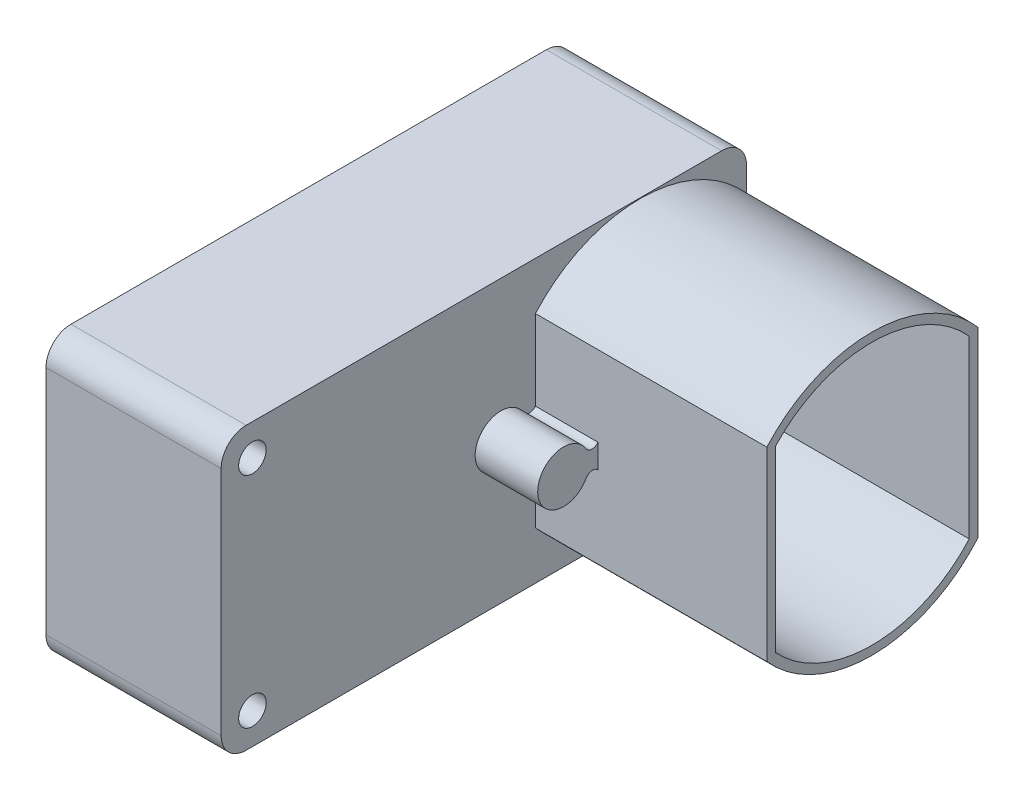
from build123d import *
from build123d.topology import SkipClean

# Parameters (mm, degrees)
SKETCH1_W           = 14
SKETCH1_H           = 42
BOSS_EXTRUDE1_DEPTH = 22.5
FILLET1_R           = 2
BOSS_EXTRUDE2_DEPTH = 18.5
BOSS_EXTRUDE3_DEPTH = 5
SKETCH4_R           = 1.1
CUT_EXTRUDE1_DEPTH  = 15
SKETCH5_W           = 2
SKETCH5_H           = 4
BOSS_EXTRUDE4_DEPTH = 5
BOSS_EXTRUDE5_DEPTH = 4
CUT_EXTRUDE2_START  = -2
CUT_EXTRUDE2_DEPTH  = 2
SKETCH12_R          = 3.5
SKETCH12_R_2        = 3.070336519
BOSS_EXTRUDE6_DEPTH = 1
SKETCH14_R          = 3
BOSS_EXTRUDE7_DEPTH = 1
SKETCH15_R          = 1
BOSS_EXTRUDE8_DEPTH = 7
SKETCH16_R          = 2
BOSS_EXTRUDE9_DEPTH = 1.5
CUT_EXTRUDE3_DEPTH  = 18.5


with BuildPart() as part:
    # Sketch1 → Boss-Extrude1 (new body)
    with BuildSketch(Plane(origin=(0, 0, 0), x_dir=(1, 0, 0), z_dir=(0, 1, 0))):
        with Locations((-14.72963025, -0.456790856)):
            Rectangle(SKETCH1_W, SKETCH1_H)
    extrude(amount=BOSS_EXTRUDE1_DEPTH)

    # Fillet1
    fillet1_edges = [part.edges().sort_by_distance(p)[0] for p in [
        (-14.72963025, 22.5, -20.543209144),
        (-14.72963025, 0, -20.543209144),
        (-14.72963025, 0, 21.456790856),
        (-14.72963025, 22.5, 21.456790856),
    ]]
    fillet(fillet1_edges, radius=FILLET1_R)

    # Sketch2 → Boss-Extrude2 (add)
    with BuildSketch(Plane(origin=(-7.72963025, 0, 0), x_dir=(0, 0, -1), z_dir=(1, 0, 0))):
        with BuildLine():
            Line((3.666133326, 18.67433994), (3.666133326, 3.82566006))
            ThreePointArc((3.666133326, 3.82566006), (12.136760187, 0.056811401), (20.543209144, 3.966716207))
            Line((20.543209144, 3.966716207), (20.543209144, 18.533283793))
            ThreePointArc((20.543209144, 18.533283793), (12.136760187, 22.443188599), (3.666133326, 18.67433994))
        make_face()
    extrude(amount=BOSS_EXTRUDE2_DEPTH)

    # Sketch3 → Boss-Extrude3 (add)
    with BuildSketch(Plane(origin=(-7.72963025, 0, 0), x_dir=(0, 0, -1), z_dir=(1, 0, 0))):
        with BuildLine():
            Line((3.666133326, 12.265446457), (3.666133326, 10.341158941))
            ThreePointArc((3.666133326, 10.341158941), (3.170141933, 10.546427574), (2.72390333, 10.248075799))
            ThreePointArc((2.72390333, 10.248075799), (-1.152649836, 11.204898318), (2.678489822, 12.329861741))
            ThreePointArc((2.678489822, 12.329861741), (3.155102255, 12.033793242), (3.666133326, 12.265446457))
        make_face()
    extrude(amount=BOSS_EXTRUDE3_DEPTH)

    # Sketch4 → Cut-Extrude1 (cut)
    with BuildSketch(Plane(origin=(-7.72963025, 0, 0), x_dir=(0, 0, -1), z_dir=(1, 0, 0))):
        with Locations((-18.956790856, 20)):
            Circle(SKETCH4_R)
        with Locations((-18.956790856, 2.5)):
            Circle(SKETCH4_R)
    extrude(amount=-CUT_EXTRUDE1_DEPTH, mode=Mode.SUBTRACT)

    # Sketch5 → Boss-Extrude4 (add)
    with BuildSketch(Plane(origin=(0, 0, -20.543209144), x_dir=(-1, 0, 0), z_dir=(0, 0, -1))):
        with Locations((7.72963025, 11.25)):
            Rectangle(SKETCH5_W, SKETCH5_H)
    extrude(amount=BOSS_EXTRUDE4_DEPTH)

    # Sketch6 → Boss-Extrude5 (add)
    with BuildSketch(Plane(origin=(-6.72963025, 0, 0), x_dir=(0, 0, -1), z_dir=(1, 0, 0))):
        with BuildLine():
            ThreePointArc((21.679339079, 11.975250565), (21.032871281, 11.616126027), (20.543209144, 12.17031195))
            Line((20.543209144, 12.17031195), (20.543209144, 10.774749435))
            ThreePointArc((20.543209144, 10.774749435), (21.198638933, 11.046780591), (21.679339079, 10.524749435))
            ThreePointArc((21.679339079, 10.524749435), (25.543209144, 11.25), (21.679339079, 11.975250565))
        make_face()
    extrude(amount=BOSS_EXTRUDE5_DEPTH)

    # Sketch7 → Cut-Extrude2 (cut)
    with BuildSketch(Plane(origin=(-6.72963025, 0, 0), x_dir=(0, 0, -1), z_dir=(1, 0, 0)).offset(CUT_EXTRUDE2_START)):
        with BuildLine():
            Line((23.543209144, 13.25), (23.543209144, 13.967200788))
            Line((23.543209144, 13.967200788), (25.760178749, 13.967200788))
            Line((25.760178749, 13.967200788), (25.760178749, 8.970470958))
            Line((25.760178749, 8.970470958), (23.543209144, 8.970470958))
            Line((23.543209144, 8.970470958), (23.543209144, 9.25))
            ThreePointArc((23.543209144, 9.25), (25.543209144, 11.25), (23.543209144, 13.25))
        make_face()
    extrude(amount=CUT_EXTRUDE2_DEPTH, mode=Mode.SUBTRACT)

    # Sketch12 → Boss-Extrude6 (add)
    with BuildSketch(Plane.ZY.offset(21.72963025)):
        with Locations(Location((10.456790856, 11.25, 0), (0, 0, 180))):
            Circle(SKETCH12_R)
        with Locations((10.456790856, 11.25)):
            Circle(SKETCH12_R_2, mode=Mode.SUBTRACT)
    extrude(amount=BOSS_EXTRUDE6_DEPTH)

    # Sketch14 → Boss-Extrude7 (add)
    with BuildSketch(Plane.ZY.offset(21.72963025)):
        with Locations(Location((10.456790856, 11.25, 0), (0, 0, 180))):
            Circle(SKETCH14_R)
    extrude(amount=BOSS_EXTRUDE7_DEPTH)

    # Sketch15 → Boss-Extrude8 (add)
    with SkipClean():  # the faces are left unmerged after this step: merging them gives an invalid solid
        with BuildSketch(Plane.ZY.offset(22.72963025)):
            with BuildLine():
                Line((8.853884636, 8.714119157), (8.853884636, 13.785880843))
                ThreePointArc((8.853884636, 13.785880843), (10.456790856, 14.25), (12.059697077, 13.785880843))
                Line((12.059697077, 13.785880843), (12.059697077, 8.714119157))
                ThreePointArc((12.059697077, 8.714119157), (10.456790856, 8.25), (8.853884636, 8.714119157))
            make_face()
            with Locations((10.456790856, 11.25)):
                Circle(SKETCH15_R, mode=Mode.SUBTRACT)
        extrude(amount=BOSS_EXTRUDE8_DEPTH)

    # Sketch16 → Boss-Extrude9 (add)
    with SkipClean():  # the faces are left unmerged after this step: merging them gives an invalid solid
        with BuildSketch(Plane.ZY.offset(21.72963025)):
            with Locations(Location((-0.543209144, 11.25, 0), (0, 0, 180))):
                Circle(SKETCH16_R)
        extrude(amount=BOSS_EXTRUDE9_DEPTH)

    # Sketch17 → Cut-Extrude3 (cut)
    with SkipClean():  # the faces are left unmerged after this step: merging them gives an invalid solid
        with BuildSketch(Plane(origin=(10.77036975, 0, 0), x_dir=(0, 0, -1), z_dir=(1, 0, 0))):
            with BuildLine():
                Line((19.843209144, 4.230369564), (19.843209144, 18.269630436))
                ThreePointArc((19.843209144, 18.269630436), (12.134214683, 21.743184905), (4.366133326, 18.403860381))
                Line((4.366133326, 18.403860381), (4.366133326, 4.096139619))
                ThreePointArc((4.366133326, 4.096139619), (12.134214683, 0.756815095), (19.843209144, 4.230369564))
            make_face()
        extrude(amount=-CUT_EXTRUDE3_DEPTH, mode=Mode.SUBTRACT)


solid = part.part
